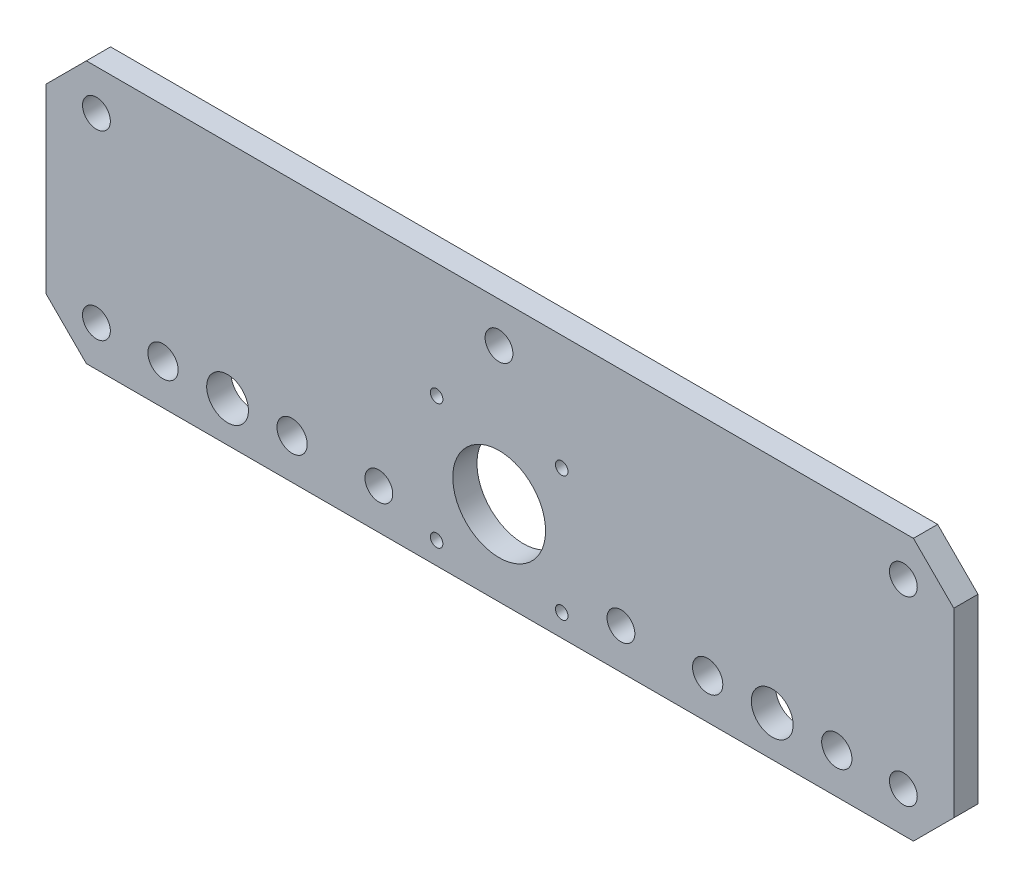
from build123d import *

# Parameters (mm, degrees)
SKETCH1_W           = 225
SKETCH1_H           = 65
SKETCH1_R           = 3.75
SKETCH1_R_2         = 5.177315147
SKETCH1_R_3         = 5.175
SKETCH1_R_4         = 3.445800431
BOSS_EXTRUDE1_DEPTH = 6
CHAMFER1_SIZE       = 10
CUT_EXTRUDE1_REACH  = 119.742
SKETCH3_R           = 1.55
SKETCH3_R_2         = 11.5


with BuildPart() as part:
    # Sketch1 → Boss-Extrude1 (new body)
    with BuildSketch(Plane.XY):
        with Locations((0, 1.720251483)):
            Rectangle(SKETCH1_W, SKETCH1_H)
        with Locations((83.5, -20.779748517)):
            Circle(SKETCH1_R, mode=Mode.SUBTRACT)
        with Locations((51.5, -20.779748517)):
            Circle(SKETCH1_R, mode=Mode.SUBTRACT)
        with Locations((67.5, -20.779748517)):
            Circle(SKETCH1_R_2, mode=Mode.SUBTRACT)
        with Locations((-51.5, -20.779748517)):
            Circle(SKETCH1_R, mode=Mode.SUBTRACT)
        with Locations((-83.5, -20.779748517)):
            Circle(SKETCH1_R, mode=Mode.SUBTRACT)
        with Locations((-67.5, -20.779748517)):
            Circle(SKETCH1_R_3, mode=Mode.SUBTRACT)
        with Locations((30, -20.779748517)):
            Circle(SKETCH1_R_4, mode=Mode.SUBTRACT)
        with Locations((-30, -20.779748517)):
            Circle(SKETCH1_R_4, mode=Mode.SUBTRACT)
        with Locations((100, -20.779748517)):
            Circle(SKETCH1_R_4, mode=Mode.SUBTRACT)
        with Locations((100, 24.220251483)):
            Circle(SKETCH1_R_4, mode=Mode.SUBTRACT)
        with Locations((-0.222785291, 24.220251483)):
            Circle(SKETCH1_R_4, mode=Mode.SUBTRACT)
        with Locations((-100, -20.779748517)):
            Circle(SKETCH1_R_4, mode=Mode.SUBTRACT)
        with Locations((-100, 24.220251483)):
            Circle(SKETCH1_R_4, mode=Mode.SUBTRACT)
    extrude(amount=BOSS_EXTRUDE1_DEPTH)

    # Chamfer1
    chamfer1_edges = [part.edges().sort_by_distance(p)[0] for p in [
        (112.5, 34.220251483, 3),
        (112.5, -30.779748517, 3),
        (-112.5, -30.779748517, 3),
        (-112.5, 34.220251483, 3),
    ]]
    chamfer(chamfer1_edges, length=CHAMFER1_SIZE)

    # Sketch3 → Cut-Extrude1 (cut, up to next)
    with BuildSketch(Plane.XY.offset(6), mode=Mode.PRIVATE) as cut_extrude1_sk1:
        with Locations((-15.680841051, -25.279748517)):
            Circle(SKETCH3_R)
    cut_extrude1_tool1 = extrude(cut_extrude1_sk1.sketch, amount=-CUT_EXTRUDE1_REACH, mode=Mode.PRIVATE) & part.part
    # Sketch3 → Cut-Extrude1 (cut, up to next)
    with BuildSketch(Plane.XY.offset(6), mode=Mode.PRIVATE) as cut_extrude1_sk2:
        with Locations((-15.680841051, 5.720251483)):
            Circle(SKETCH3_R)
    cut_extrude1_tool2 = extrude(cut_extrude1_sk2.sketch, amount=-CUT_EXTRUDE1_REACH, mode=Mode.PRIVATE) & part.part
    # Sketch3 → Cut-Extrude1 (cut, up to next)
    with BuildSketch(Plane.XY.offset(6), mode=Mode.PRIVATE) as cut_extrude1_sk3:
        with Locations((15.319158949, 5.720251483)):
            Circle(SKETCH3_R)
    cut_extrude1_tool3 = extrude(cut_extrude1_sk3.sketch, amount=-CUT_EXTRUDE1_REACH, mode=Mode.PRIVATE) & part.part
    # Sketch3 → Cut-Extrude1 (cut, up to next)
    with BuildSketch(Plane.XY.offset(6), mode=Mode.PRIVATE) as cut_extrude1_sk4:
        with Locations((15.319158949, -25.279748517)):
            Circle(SKETCH3_R)
    cut_extrude1_tool4 = extrude(cut_extrude1_sk4.sketch, amount=-CUT_EXTRUDE1_REACH, mode=Mode.PRIVATE) & part.part
    # Sketch3 → Cut-Extrude1 (cut, up to next)
    with BuildSketch(Plane.XY.offset(6), mode=Mode.PRIVATE) as cut_extrude1_sk5:
        with Locations((-0.180841051, -9.779748517)):
            Circle(SKETCH3_R_2)
    cut_extrude1_tool5 = extrude(cut_extrude1_sk5.sketch, amount=-CUT_EXTRUDE1_REACH, mode=Mode.PRIVATE) & part.part
    add(cut_extrude1_tool1.solids().sort_by_distance((-15.680841, -25.279749, 6))[0], mode=Mode.SUBTRACT)
    add(cut_extrude1_tool2.solids().sort_by_distance((-15.680841, 5.720251, 6))[0], mode=Mode.SUBTRACT)
    add(cut_extrude1_tool3.solids().sort_by_distance((15.319159, 5.720251, 6))[0], mode=Mode.SUBTRACT)
    add(cut_extrude1_tool4.solids().sort_by_distance((15.319159, -25.279749, 6))[0], mode=Mode.SUBTRACT)
    add(cut_extrude1_tool5.solids().sort_by_distance((-0.180841, -9.779749, 6))[0], mode=Mode.SUBTRACT)


solid = part.part
